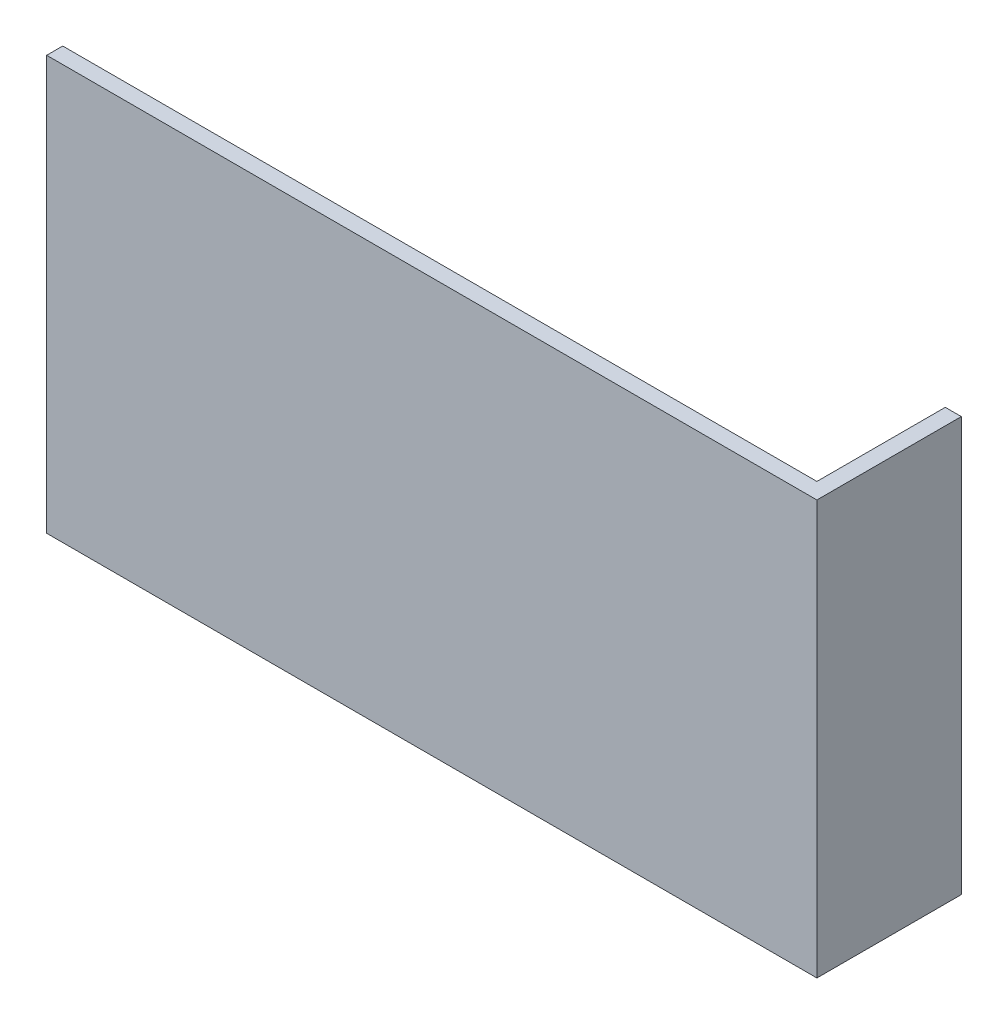
from build123d import *

# Parameters (mm, degrees)
SKETCH1_W           = 152.4
SKETCH1_H           = 81.915
BOSS_EXTRUDE2_DEPTH = 3.175
SKETCH4_W           = 3.175
SKETCH4_H           = 81.915
BOSS_EXTRUDE4_DEPTH = 25.4


with BuildPart() as part:
    # Sketch1 → Boss-Extrude2 (new body)
    with BuildSketch(Plane.XY):
        with Locations((39.761186859, 38.751243736)):
            Rectangle(SKETCH1_W, SKETCH1_H)
    extrude(amount=BOSS_EXTRUDE2_DEPTH)

    # Sketch4 → Boss-Extrude4 (add)
    with BuildSketch(Plane(origin=(0, 0, 0), x_dir=(-1, 0, 0), z_dir=(0, 0, -1))):
        with Locations((-114.373686859, 38.751243736)):
            Rectangle(SKETCH4_W, SKETCH4_H)
    extrude(amount=BOSS_EXTRUDE4_DEPTH)


solid = part.part
